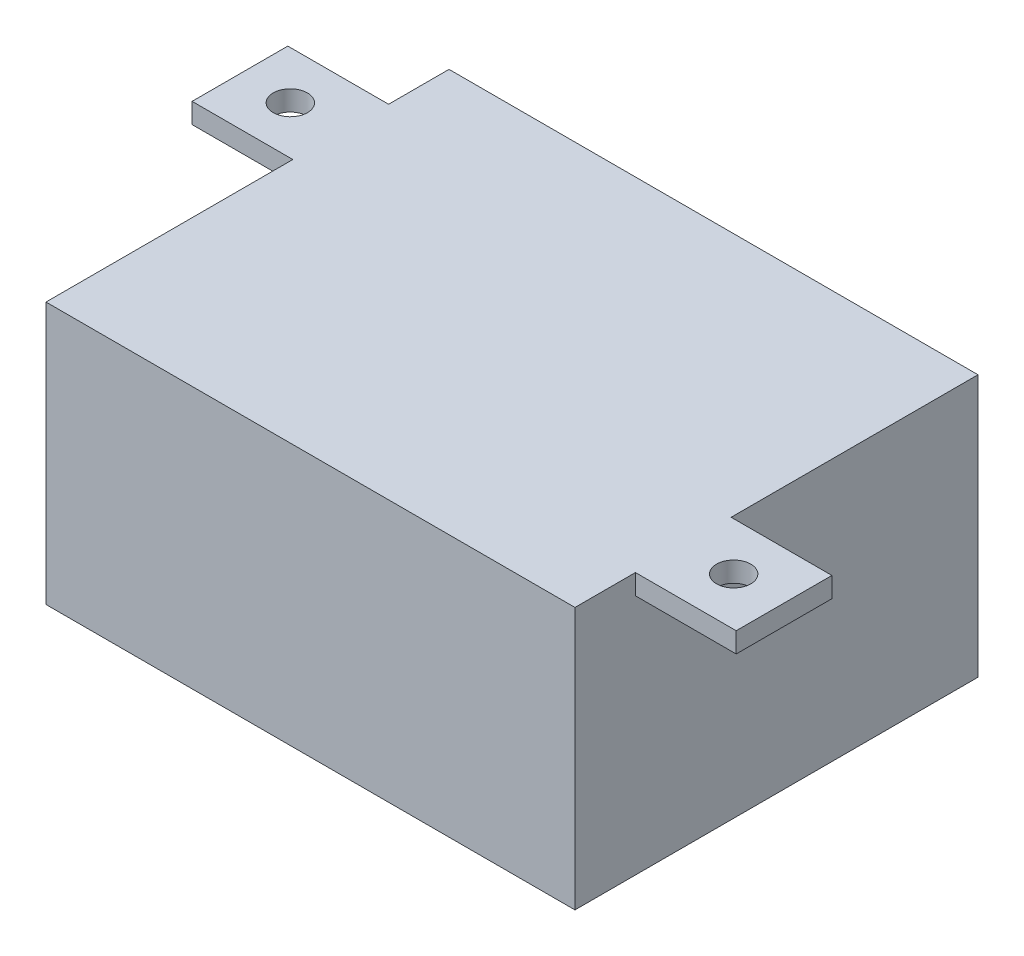
from build123d import *

# Parameters (mm, degrees)
CASE_START    = 66.57
CASE_SKETCH_W = 52.5
CASE_SKETCH_H = 40
CASE_2_DEPTH  = 26
EARS_START    = 90.57
EARS_SKETCH_W = 10
EARS_SKETCH_H = 9.5
EARS_SKETCH_R = 1.7
EARS_DEPTH    = 2


with BuildPart() as part:
    # Case Sketch → Case 2 (new body)
    with BuildSketch(Plane(origin=(0, 0, 0), x_dir=(1, 0, 0), z_dir=(0, 1, 0)).offset(CASE_START)):
        Rectangle(CASE_SKETCH_W, CASE_SKETCH_H)
    extrude(amount=CASE_2_DEPTH)

    # Ears Sketch → Ears (add)
    # profile 1 of 2: a face of its own
    with BuildSketch(Plane(origin=(0, 0, 0), x_dir=(1, 0, 0), z_dir=(0, 1, 0)).offset(EARS_START)):
        with Locations((31.25, -9.25)):
            Rectangle(EARS_SKETCH_W, EARS_SKETCH_H)
        with Locations((31.25, -9.25)):
            Circle(EARS_SKETCH_R, mode=Mode.SUBTRACT)
    # profile 2 of 2: a face of its own
    with BuildSketch(Plane(origin=(0, 0, 0), x_dir=(1, 0, 0), z_dir=(0, 1, 0)).offset(EARS_START)):
        with Locations((-31.25, 9.25)):
            Rectangle(EARS_SKETCH_W, EARS_SKETCH_H)
        with Locations((-31.25, 9.25)):
            Circle(EARS_SKETCH_R, mode=Mode.SUBTRACT)
    extrude(amount=EARS_DEPTH)


solid = part.part
